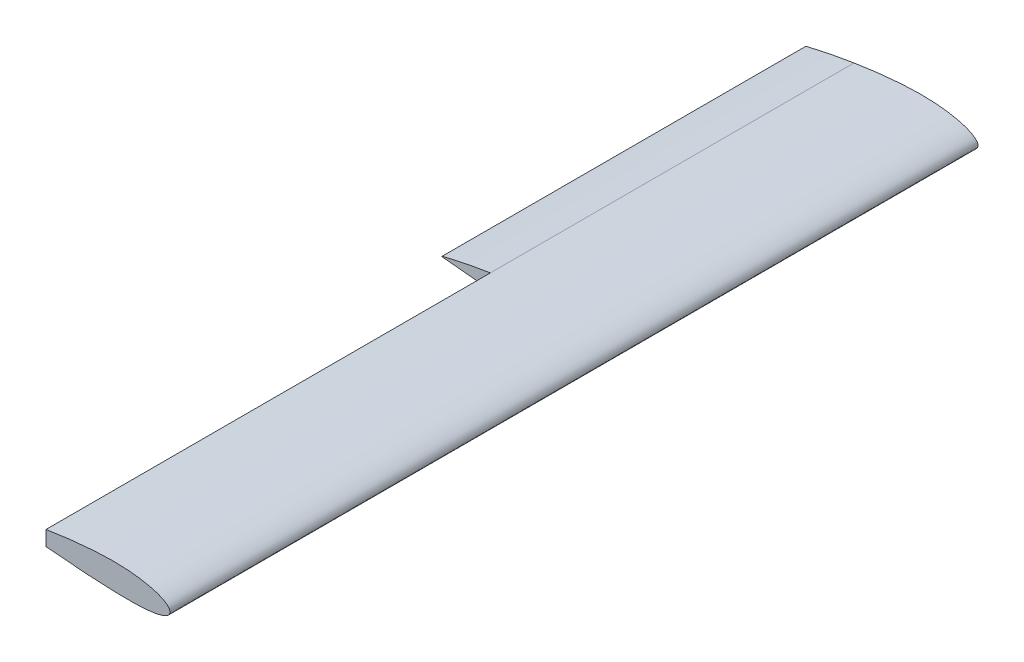
from build123d import *

# Parameters (mm, degrees)
BOSS_EXTRUDE1_DEPTH = 1120
BOSS_EXTRUDE2_DEPTH = 504
SKETCH3_R           = 12.7
CUT_EXTRUDE2_DEPTH  = 800


with BuildPart() as part:
    # Sketch1 → Boss-Extrude1 (new body)
    with BuildSketch(Plane.XY):
        with BuildLine():
            Line((-171.846, 13.802437795), (-171.846, -6.885945817))
            add(Edge.make_bspline(
                [(-171.846, 13.802437795), (-169.687195915, 14.146608219), (-164.597904491, 14.957975772), (-156.487198096, 16.142253603), (-147.460336343, 17.370404658), (-138.251119141, 18.509863587), (-128.91726091, 19.545491819), (-119.516780163, 20.457589719), (-110.108636731, 21.229014604), (-100.738687873, 21.842612064), (-91.448634267, 22.288155063), (-82.295790198, 22.495969861), (-73.354832572, 22.463929008), (-64.702828584, 22.18711462), (-56.397940477, 21.667769113), (-48.495875722, 20.912185856), (-41.049350171, 19.931395959), (-34.10749814, 18.740733947), (-27.715339735, 17.359414779), (-21.913282389, 15.809833244), (-16.73665061, 14.116648387), (-12.215187057, 12.305641332), (-8.372488395, 10.402139974), (-5.225239405, 8.428904048), (-2.783157587, 6.401540541), (-1.052244784, 4.322610537), (-0.056660018, 2.172493692), (0.129841681, -0.013040918), (-0.485118951, -2.116648366), (-1.873876517, -4.027820142), (-3.951712439, -5.73405902), (-6.693728323, -7.267300245), (-10.088688623, -8.637294366), (-14.120806225, -9.844419373), (-18.768065608, -10.885539045), (-24.003355548, -11.757837546), (-29.795659026, -12.460153718), (-36.110844654, -12.993800718), (-42.912190191, -13.362969431), (-50.160721884, -13.574922495), (-57.815433259, -13.639960871), (-65.833426064, -13.571253014), (-74.169986794, -13.384258056), (-82.778692186, -13.096889474), (-91.628583698, -12.725343858), (-100.6830751, -12.294655463), (-109.886493182, -11.766197657), (-119.166555289, -11.162114496), (-128.453974413, -10.498197235), (-137.692554642, -9.790268876), (-146.826066097, -9.052699068), (-155.798515887, -8.297745307), (-164.120854312, -7.576719647), (-169.445500495, -7.10059578), (-171.846, -6.885945817)],
                knots=[0, 0, 0, 0, 0.018424224, 0.043434346, 0.069080412, 0.095203092, 0.121640117, 0.148227444, 0.17480049, 0.201195447, 0.227363977, 0.253181792, 0.278347264, 0.302710399, 0.326128333, 0.348466602, 0.369600377, 0.389415723, 0.407811011, 0.424698681, 0.44000774, 0.453687637, 0.465714725, 0.476103672, 0.484928355, 0.492360154, 0.498730164, 0.504586951, 0.510443348, 0.516803825, 0.524198712, 0.532940661, 0.543185695, 0.554995644, 0.568376342, 0.583298542, 0.599709376, 0.617538825, 0.636703502, 0.65710892, 0.678650912, 0.701216586, 0.724685048, 0.748928058, 0.7738107, 0.799337901, 0.825325561, 0.851504471, 0.877716004, 0.903800001, 0.929595993, 0.954944401, 0.979687675, 1, 1, 1, 1], degree=3))
        make_face()
    extrude(amount=BOSS_EXTRUDE1_DEPTH)

    # Sketch2 → Boss-Extrude2 (add)
    with BuildSketch(Plane.XY):
        with BuildLine():
            Line((-171.846, 13.802437795), (-171.846, -6.885945817))
            add(Edge.make_bspline(
                [(-171.846, -6.885945817), (-172.279902363, -6.847380871), (-175.440788036, -6.566443507), (-181.20260448, -6.039037107), (-188.990475627, -5.318490675), (-196.354667503, -4.624027661), (-203.248715472, -3.963662315), (-209.62869157, -3.342827921), (-215.45375872, -2.767227992), (-220.68642467, -2.242557883), (-225.292785955, -1.773651923), (-229.242958682, -1.367494105), (-232.510834877, -1.023880311), (-235.075678546, -0.760955177), (-236.918777596, -0.548714441), (-238.031628616, -0.459131063), (-238.533564191, -0.37457711), (-238.666663293, -0.375050863), (-238.675, -0.375080537)],
                knots=[0, 0, 0, 0, 0.019462551, 0.14178051, 0.258505433, 0.368899529, 0.472261554, 0.567931303, 0.655293986, 0.733784513, 0.802891701, 0.862162346, 0.911205133, 0.949694244, 0.977372582, 0.994054454, 0.999627599, 1, 1, 1, 1], degree=3))
            Line((-238.675, -0.375080537), (-238.675, 0.381187438))
            add(Edge.make_bspline(
                [(-171.846, 13.802437795), (-172.525257616, 13.696039939), (-175.933119288, 13.16223779), (-181.929700077, 12.142616472), (-189.692578637, 10.773435489), (-197.014829139, 9.410068419), (-203.853725709, 8.079803357), (-210.168184203, 6.800314366), (-215.920853202, 5.591321475), (-221.077844696, 4.471475693), (-225.608999658, 3.458736193), (-229.487989982, 2.569844783), (-232.692417395, 1.819938124), (-235.203893788, 1.222163617), (-237.008061317, 0.787162185), (-238.08635023, 0.525005253), (-238.562115977, 0.408767052), (-238.675, 0.381187438)],
                knots=[0, 0, 0, 0, 0.030251696, 0.151773928, 0.267626296, 0.377089872, 0.479484952, 0.574174897, 0.660569789, 0.738129949, 0.806369318, 0.864858701, 0.913228834, 0.951173208, 0.978450569, 0.994887008, 1, 1, 1, 1], degree=3))
        make_face()
    extrude(amount=BOSS_EXTRUDE2_DEPTH)

    # Sketch3 → Cut-Extrude2 (cut)
    with BuildSketch(Plane.XY):
        with Locations((-71.603, 4.475)):
            Circle(SKETCH3_R)
    extrude(amount=CUT_EXTRUDE2_DEPTH, mode=Mode.SUBTRACT)


solid = part.part
